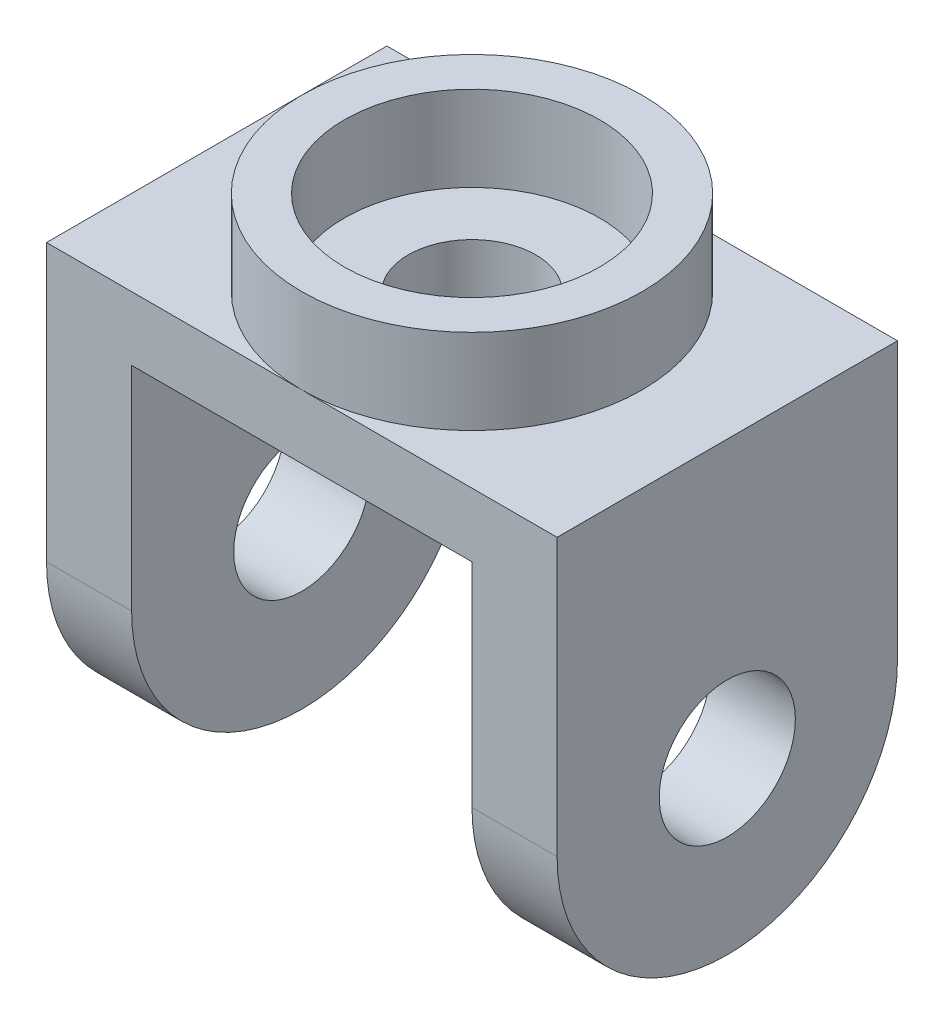
from build123d import *

# Parameters (mm, degrees)
SKETCH2_W           = 120000
SKETCH2_H           = 80000
BOSS_EXTRUDE1_DEPTH = 15000
SKETCH3_R           = 40000
SKETCH3_R_2         = 30000
BOSS_EXTRUDE2_DEPTH = 20000
SKETCH4_R           = 15000
CUT_EXTRUDE1_DEPTH  = 20000
SKETCH7_W           = 80000
SKETCH7_H           = 50000
BOSS_EXTRUDE4_DEPTH = 20000
BOSS_EXTRUDE5_DEPTH = 20000
SKETCH11_R          = 16000
CUT_EXTRUDE3_DEPTH  = 20499.960430488
BOSS_EXTRUDE7_START = -20000
BOSS_EXTRUDE7_DEPTH = 20000
CUT_EXTRUDE4_START  = -20000
SKETCH15_R          = 16000
CUT_EXTRUDE4_DEPTH  = 20000


with BuildPart() as part:
    # Sketch2 → Boss-Extrude1 (new body)
    with BuildSketch(Plane(origin=(0, 0, 0), x_dir=(1, 0, 0), z_dir=(0, 1, 0))):
        Rectangle(SKETCH2_W, SKETCH2_H)
    extrude(amount=BOSS_EXTRUDE1_DEPTH)

    # Sketch3 → Boss-Extrude2 (add)
    with BuildSketch(Plane(origin=(0, 15000, 0), x_dir=(1, 0, 0), z_dir=(0, 1, 0))):
        with Locations(Location((0, 0, 0), (0, 0, 270))):
            Circle(SKETCH3_R)
        with Locations(Location((0, 0, 0), (0, 0, 270))):
            Circle(SKETCH3_R_2, mode=Mode.SUBTRACT)
    extrude(amount=BOSS_EXTRUDE2_DEPTH)

    # Sketch4 → Cut-Extrude1 (cut)
    with BuildSketch(Plane(origin=(0, 15000, 0), x_dir=(1, 0, 0), z_dir=(0, 1, 0))):
        with Locations(Location((0, 0, 0), (0, 0, 270))):
            Circle(SKETCH4_R)
    extrude(amount=-CUT_EXTRUDE1_DEPTH, mode=Mode.SUBTRACT)

    # Sketch7 → Boss-Extrude4 (add)
    with BuildSketch(Plane.ZY.offset(60000)):
        with Locations((0, -25000)):
            Rectangle(SKETCH7_W, SKETCH7_H)
    extrude(amount=-BOSS_EXTRUDE4_DEPTH)

    # Sketch9 → Boss-Extrude5 (add)
    with BuildSketch(Plane.ZY.offset(60000)):
        with BuildLine():
            Line((-40000, -50000), (40000, -50000))
            ThreePointArc((40000, -50000), (0, -90000), (-40000, -50000))
        make_face()
    extrude(amount=-BOSS_EXTRUDE5_DEPTH)

    # Sketch11 → Cut-Extrude3 (cut)
    with BuildSketch(Plane.ZY.offset(60000)):
        with Locations((0, -50000)):
            Circle(SKETCH11_R)
    extrude(amount=-CUT_EXTRUDE3_DEPTH, mode=Mode.SUBTRACT)

    # Sketch14 → Boss-Extrude7 (add)
    with BuildSketch(Plane(origin=(60000, 0, 0), x_dir=(0, 0, -1), z_dir=(1, 0, 0)).offset(BOSS_EXTRUDE7_START)):
        with BuildLine():
            Line((-40000, 0), (40000, 0))
            Line((40000, 0), (40000, -50000))
            ThreePointArc((40000, -50000), (0, -90000), (-40000, -50000))
            Line((-40000, -50000), (-40000, 0))
        make_face()
    extrude(amount=BOSS_EXTRUDE7_DEPTH)

    # Sketch15 → Cut-Extrude4 (cut)
    with BuildSketch(Plane(origin=(60000, 0, 0), x_dir=(0, 0, -1), z_dir=(1, 0, 0)).offset(CUT_EXTRUDE4_START)):
        with Locations(Location((0, -50000, 0), (0, 0, 180))):
            Circle(SKETCH15_R)
    extrude(amount=CUT_EXTRUDE4_DEPTH, mode=Mode.SUBTRACT)


solid = part.part
